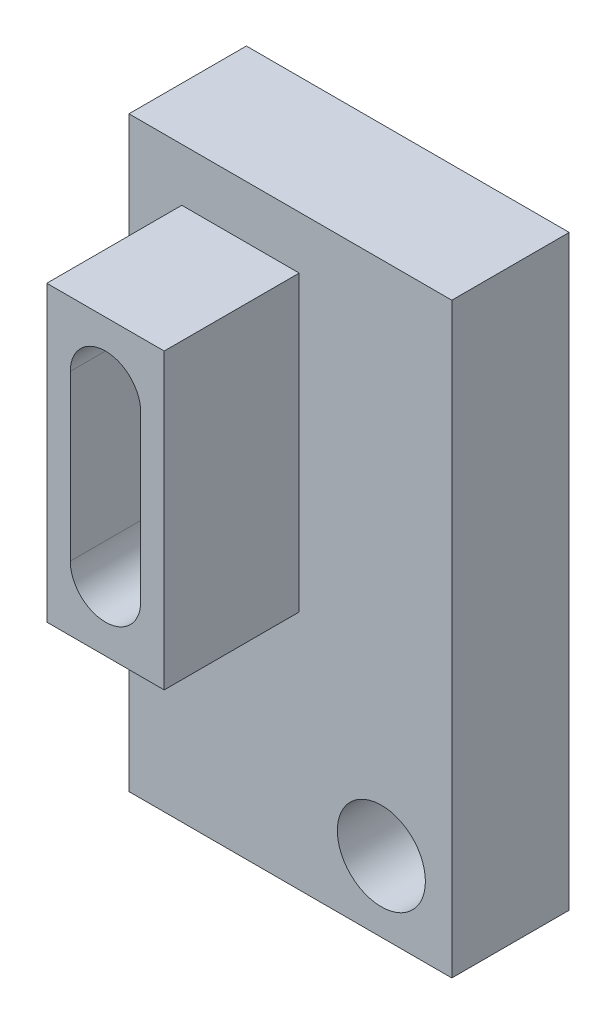
from build123d import *

# Parameters (mm, degrees)
SKETCH_1_W          = 55
SKETCH_1_H          = 100
EXTRUDE_1_DEPTH     = 20
SKETCH_2_R          = 7.5
CUT_EXTRUDE_1_DEPTH = 61.466933112
SKETCH_3_W          = 20
SKETCH_3_H          = 50
EXTRUDE_2_DEPTH     = 23
CUT_EXTRUDE_2_DEPTH = 72.451032183


with BuildPart() as part:
    # Эскиз1 → Бобышка-Вытянуть1 (new body)
    with BuildSketch(Plane.XY):
        Rectangle(SKETCH_1_W, SKETCH_1_H)
    extrude(amount=EXTRUDE_1_DEPTH)

    # Эскиз2 → Вырез-Вытянуть1 (cut, through all)
    with BuildSketch(Plane.XY.offset(20)):
        with Locations((15.5, -38)):
            Circle(SKETCH_2_R)
    extrude(amount=-CUT_EXTRUDE_1_DEPTH, mode=Mode.SUBTRACT)

    # Эскиз3 → Бобышка-Вытянуть2 (add)
    with BuildSketch(Plane.XY.offset(20)):
        with Locations((-8.5, 16)):
            Rectangle(SKETCH_3_W, SKETCH_3_H)
    extrude(amount=EXTRUDE_2_DEPTH)

    # Эскиз4 → Вырез-Вытянуть2 (cut, through all)
    with BuildSketch(Plane.XY.offset(43)):
        with BuildLine():
            Line((-14.5, 2), (-14.5, 30))
            ThreePointArc((-14.5, 30), (-8.5, 36), (-2.5, 30))
            Line((-2.5, 30), (-2.5, 2))
            ThreePointArc((-2.5, 2), (-8.5, -4), (-14.5, 2))
        make_face()
    extrude(amount=-CUT_EXTRUDE_2_DEPTH, mode=Mode.SUBTRACT)


solid = part.part
